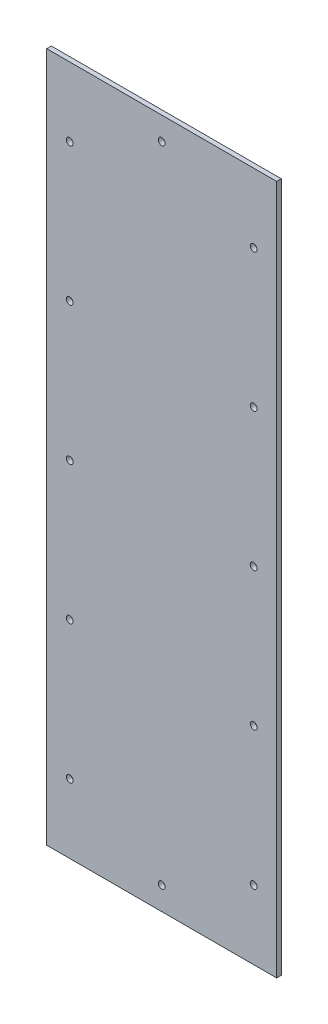
from build123d import *

# Parameters (mm, degrees)
SKETCH1_W           = 100
SKETCH1_H           = 300
BOSS_EXTRUDE1_DEPTH = 2
SKETCH3_R           = 1.5
CUT_EXTRUDE1_DEPTH  = 317.234090509


with BuildPart() as part:
    # Sketch1 → Boss-Extrude1 (new body)
    with BuildSketch(Plane.XY):
        with Locations((50, -150)):
            Rectangle(SKETCH1_W, SKETCH1_H)
    extrude(amount=BOSS_EXTRUDE1_DEPTH)

    # Sketch3 → Cut-Extrude1 (cut, through all)
    with BuildSketch(Plane.XY.offset(2)):
        with Locations((10, -30)):
            Circle(SKETCH3_R)
        with Locations((10, -90)):
            Circle(SKETCH3_R)
        with Locations((10, -150)):
            Circle(SKETCH3_R)
        with Locations(Location((10, -210, 0), (0, 0, 180))):
            Circle(SKETCH3_R)
        with Locations(Location((10, -270, 0), (0, 0, 180))):
            Circle(SKETCH3_R)
        with Locations(Location((90, -150, 0), (0, 0, 180))):
            Circle(SKETCH3_R)
        with Locations(Location((90, -90, 0), (0, 0, 180))):
            Circle(SKETCH3_R)
        with Locations(Location((90, -30, 0), (0, 0, 180))):
            Circle(SKETCH3_R)
        with Locations((90, -270)):
            Circle(SKETCH3_R)
        with Locations((90, -210)):
            Circle(SKETCH3_R)
        with Locations((50, -10)):
            Circle(SKETCH3_R)
        with Locations(Location((50, -290, 0), (0, 0, 180))):
            Circle(SKETCH3_R)
    extrude(amount=-CUT_EXTRUDE1_DEPTH, mode=Mode.SUBTRACT)


solid = part.part
